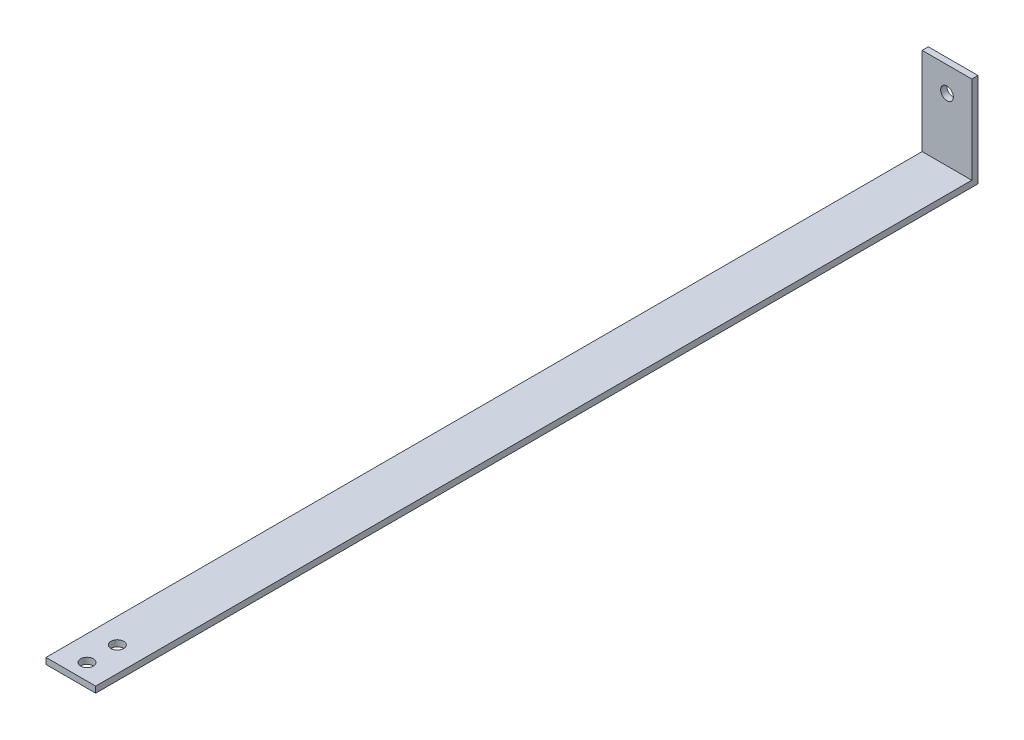
from build123d import *

# Parameters (mm, degrees)
SALIENTE_EXTRUIR1_DEPTH = 50.8
CROQUIS2_R              = 6.5
CORTAR_EXTRUIR1_DEPTH   = 10
CROQUIS3_R              = 6.5
CORTAR_EXTRUIR2_DEPTH   = 10


with BuildPart() as part:
    # Croquis1 → Saliente-Extruir1 (new body)
    with BuildSketch(Plane(origin=(0, 0, 0), x_dir=(0, 0, -1), z_dir=(1, 0, 0))):
        Polygon((-6.31, 95.93), (0, 95.93), (0, 0), (-902.2, 0), (-902.2, 6.31), (-6.31, 6.31), align=None)
    extrude(amount=SALIENTE_EXTRUIR1_DEPTH)

    # Croquis2 → Cortar-Extruir1 (cut)
    with BuildSketch(Plane(origin=(0, 0, 0), x_dir=(-1, 0, 0), z_dir=(0, -1, 0))):
        with Locations(Location((-25.4, -885.7, 0), (0, 0, 90))):
            Circle(CROQUIS2_R)
        with Locations(Location((-25.4, -854.7, 0), (0, 0, 90))):
            Circle(CROQUIS2_R)
    extrude(amount=-CORTAR_EXTRUIR1_DEPTH, mode=Mode.SUBTRACT)

    # Croquis3 → Cortar-Extruir2 (cut)
    with BuildSketch(Plane(origin=(0, 0, 0), x_dir=(-1, 0, 0), z_dir=(0, 0, -1))):
        with Locations(Location((-25.4, 70.53, 0), (0, 0, 90))):
            Circle(CROQUIS3_R)
    extrude(amount=-CORTAR_EXTRUIR2_DEPTH, mode=Mode.SUBTRACT)


solid = part.part
